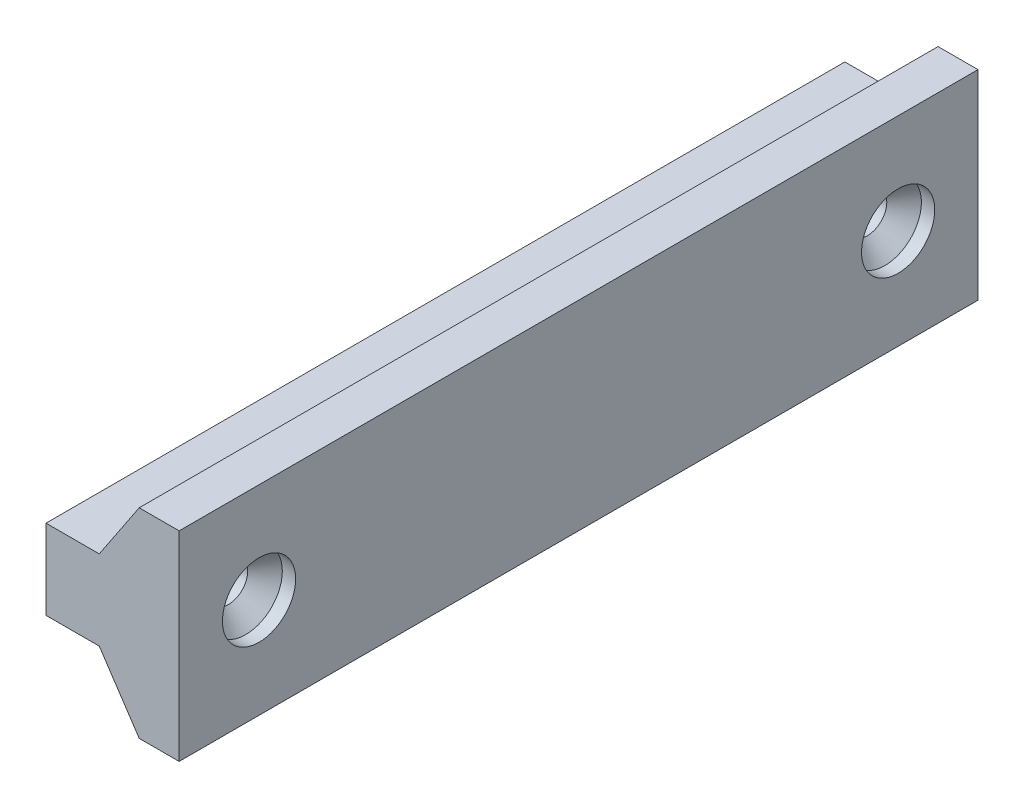
from build123d import *

# Parameters (mm, degrees)
EXTRUDE_1_DEPTH               = 30
SKETCH_5_R                    = 2.75
CUT_EXTRUDE_1_DEPTH           = 1
HOLE_WIZARD_M2_52_D           = 2.9
HOLE_WIZARD_M2_52_CSINK_D     = 5.5
HOLE_WIZARD_M2_52_CSINK_ANGLE = 90


with BuildPart() as part:
    # Эскиз1 → Бобышка-Вытянуть1 (new, symmetric)
    with BuildSketch(Plane.XY):
        Polygon((-10, -3), (-10, 3), (-6, 3), (-3, 7.5), (0, 7.5), (0, -7.5), (-3, -7.5), (-6, -3), align=None)
    extrude(amount=EXTRUDE_1_DEPTH, both=True)

    # Эскиз5 → Вырез-Вытянуть1 (cut)
    with BuildSketch(Plane(origin=(0, 0, 0), x_dir=(0, 0, -1), z_dir=(1, 0, 0))):
        with Locations((-24, 0)):
            Circle(SKETCH_5_R)
        with Locations((24, 0)):
            Circle(SKETCH_5_R)
    extrude(amount=-CUT_EXTRUDE_1_DEPTH, mode=Mode.SUBTRACT)

    # Зенковка для винта с потайной головкой M2.52 (through all)
    with Locations(Plane(origin=(-1, 0, 0), x_dir=(0, 0, -1), z_dir=(1, 0, 0))):
        with Locations((-24, 0), (24, 0)):
            CounterSinkHole(HOLE_WIZARD_M2_52_D / 2, HOLE_WIZARD_M2_52_CSINK_D / 2, counter_sink_angle=HOLE_WIZARD_M2_52_CSINK_ANGLE)


solid = part.part
